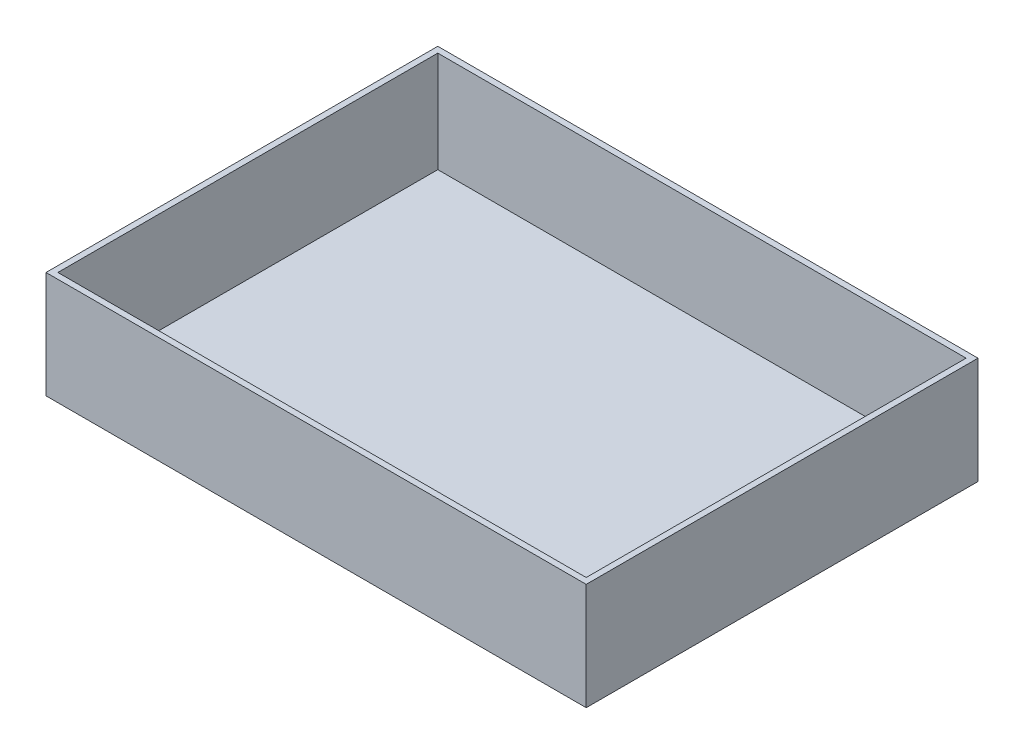
from build123d import *

# Parameters (mm, degrees)
SKETCH1_W           = 455
SKETCH1_H           = 330
BOSS_EXTRUDE1_DEPTH = 45
SHELL1_T            = -5


with BuildPart() as part:
    # Sketch1 → Boss-Extrude1 (new, symmetric)
    with BuildSketch(Plane(origin=(0, 0, 0), x_dir=(1, 0, 0), z_dir=(0, 1, 0))):
        Rectangle(SKETCH1_W, SKETCH1_H)
    extrude(amount=BOSS_EXTRUDE1_DEPTH, both=True)

    # Shell1
    shell1_openings = [part.faces().sort_by_distance(p)[0] for p in [
        (0, 45, 0),
    ]]
    offset(amount=SHELL1_T, openings=shell1_openings, kind=Kind.INTERSECTION)


solid = part.part
